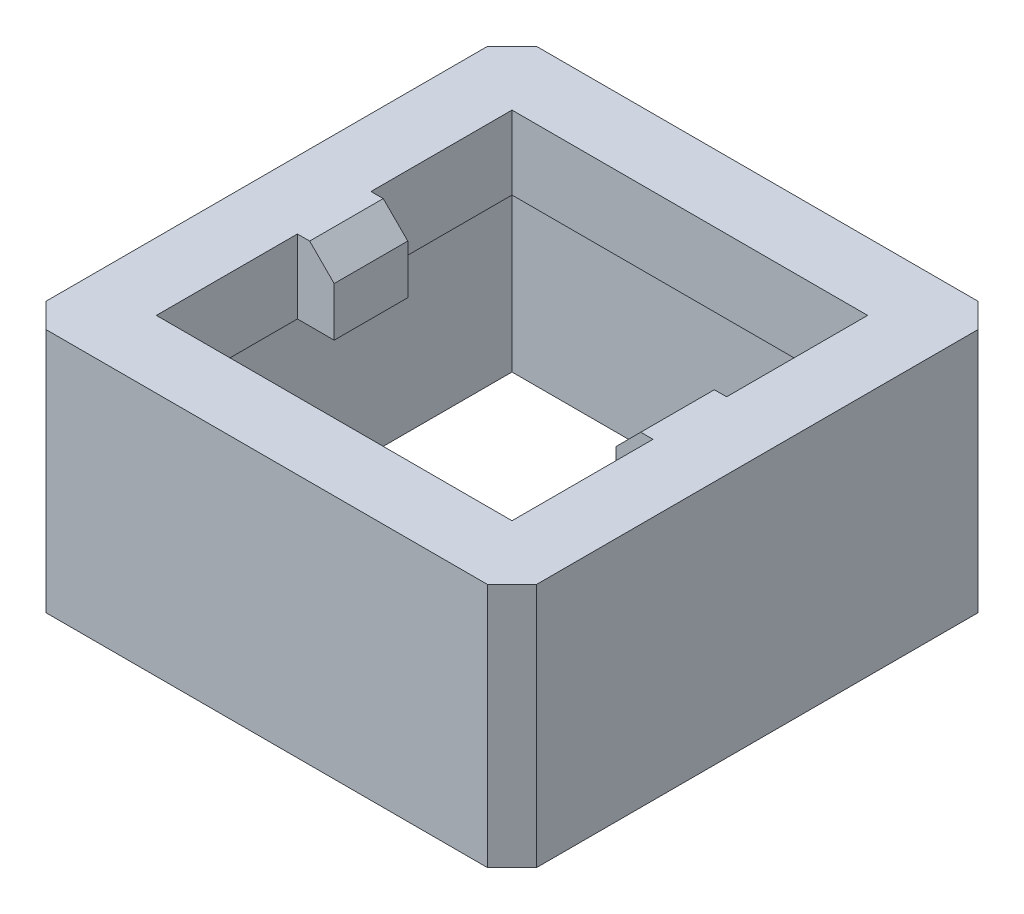
from build123d import *

# Parameters (mm, degrees)
SKETCH1_W           = 20
SKETCH1_H           = 20
BOSS_EXTRUDE1_DEPTH = 3
SKETCH2_W           = 14.5
SKETCH2_H           = 14.5
CUT_EXTRUDE1_DEPTH  = 3
SKETCH3_W           = 1.5
SKETCH3_H           = 3
BOSS_EXTRUDE2_DEPTH = 3
CHAMFER1_SIZE       = 1
SKETCH4_W           = 20
SKETCH4_H           = 20
SKETCH4_W_2         = 16
SKETCH4_H_2         = 16
BOSS_EXTRUDE3_DEPTH = 7
CHAMFER2_SIZE       = 1


with BuildPart() as part:
    # Sketch1 → Boss-Extrude1 (new body)
    with BuildSketch(Plane(origin=(0, 0, 0), x_dir=(1, 0, 0), z_dir=(0, 1, 0))):
        Rectangle(SKETCH1_W, SKETCH1_H)
    extrude(amount=BOSS_EXTRUDE1_DEPTH)

    # Sketch2 → Cut-Extrude1 (cut)
    with BuildSketch(Plane(origin=(0, 3, 0), x_dir=(1, 0, 0), z_dir=(0, 1, 0))):
        Rectangle(SKETCH2_W, SKETCH2_H)
    extrude(amount=-CUT_EXTRUDE1_DEPTH, mode=Mode.SUBTRACT)

    # Sketch3 → Boss-Extrude2 (add)
    with BuildSketch(Plane(origin=(0, 3, 0), x_dir=(1, 0, 0), z_dir=(0, 1, 0))):
        with Locations((6.5, 0)):
            Rectangle(SKETCH3_W, SKETCH3_H)
        with Locations((-6.5, 0)):
            Rectangle(SKETCH3_W, SKETCH3_H)
    extrude(amount=-BOSS_EXTRUDE2_DEPTH)

    # Chamfer1
    chamfer1_edges = [part.edges().sort_by_distance(p)[0] for p in [
        (5.75, 3, 0),
        (-5.75, 3, 0),
    ]]
    chamfer(chamfer1_edges, length=CHAMFER1_SIZE)

    # Sketch4 → Boss-Extrude3 (add)
    with BuildSketch(Plane.XZ):
        Rectangle(SKETCH4_W, SKETCH4_H)
        Rectangle(SKETCH4_W_2, SKETCH4_H_2, mode=Mode.SUBTRACT)
    extrude(amount=BOSS_EXTRUDE3_DEPTH)

    # Chamfer2
    chamfer2_edges = [part.edges().sort_by_distance(p)[0] for p in [
        (10, -2, 10),
        (-10, -2, 10),
        (-10, -2, -10),
        (10, -2, -10),
    ]]
    chamfer(chamfer2_edges, length=CHAMFER2_SIZE)


solid = part.part
